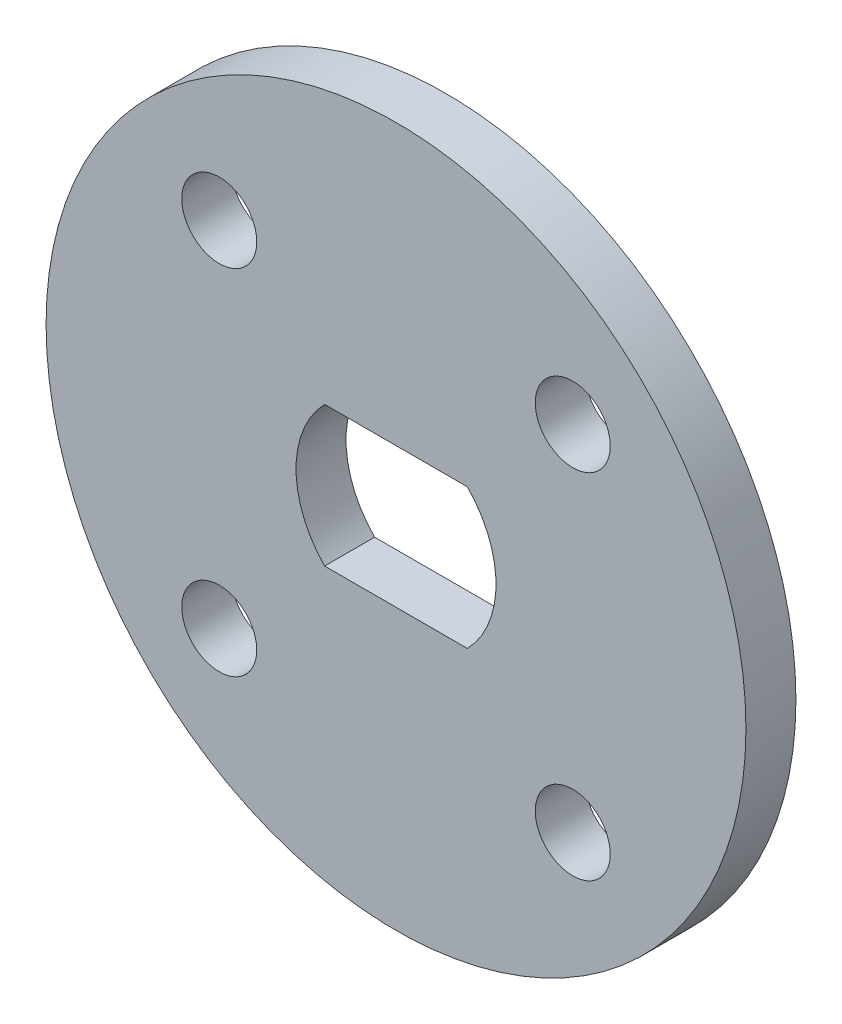
from build123d import *

# Parameters (mm, degrees)
SKETCH_1_R          = 14
SKETCH_1_R_2        = 1.5
EXTRUDE_1_DEPTH     = 2
CUT_EXTRUDE_1_DEPTH = 20.899748742


with BuildPart() as part:
    # 草图1 → 凸台-拉伸1 (new body)
    with BuildSketch(Plane.XY):
        Circle(SKETCH_1_R)
        with Locations((-7.071067812, 7.071067812)):
            Circle(SKETCH_1_R_2, mode=Mode.SUBTRACT)
        with Locations((7.071067812, 7.071067812)):
            Circle(SKETCH_1_R_2, mode=Mode.SUBTRACT)
        with Locations((-7.071067812, -7.071067812)):
            Circle(SKETCH_1_R_2, mode=Mode.SUBTRACT)
        with Locations((7.071067812, -7.071067812)):
            Circle(SKETCH_1_R_2, mode=Mode.SUBTRACT)
    extrude(amount=EXTRUDE_1_DEPTH)

    # 草图2 → 切除-拉伸1 (cut, through all)
    with BuildSketch(Plane(origin=(0, 0, 0), x_dir=(-1, 0, 0), z_dir=(0, 0, -1))):
        with BuildLine():
            Line((-2.856571371, 2.8), (2.856571371, 2.8))
            ThreePointArc((2.856571371, 2.8), (4, 0), (2.856571371, -2.8))
            Line((2.856571371, -2.8), (-2.856571371, -2.8))
            ThreePointArc((-2.856571371, -2.8), (-4, 0), (-2.856571371, 2.8))
        make_face()
    extrude(amount=-CUT_EXTRUDE_1_DEPTH, mode=Mode.SUBTRACT)


solid = part.part
